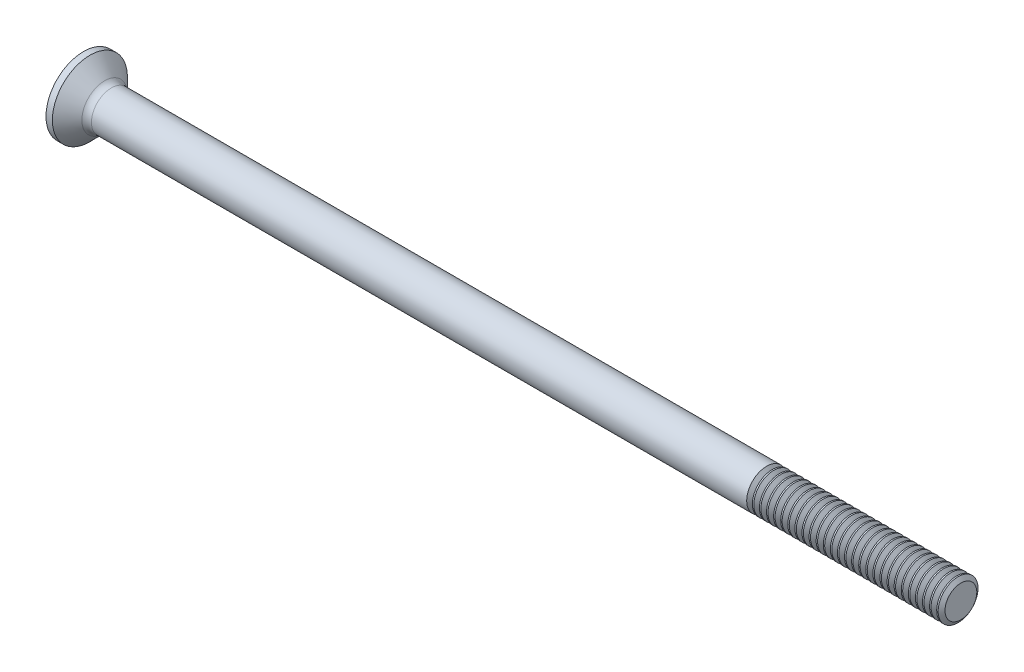
from build123d import *

# Parameters (mm, degrees)
FILLET1_R       = 0.6
RECPAT_COUNT    = 2
RECPAT_ANGLE    = 90
THDSCHPAT_COUNT = 28
THDSCHPAT_PITCH = 0.444444444


with BuildPart() as part:
    # BodySke → Base-Revolve (revolve)
    with BuildSketch(Plane.XY, mode=Mode.PRIVATE) as base_revolve_sk:
        Polygon((0, 0), (0, 2.35), (0.4, 2.35), (1.5, 1.25), (55, 1.25), (55, 0), align=None)
    revolve(base_revolve_sk.sketch.rotate(Axis((-6.35, 0, 0), (1, 0, 0)), 90), axis=Axis((-6.35, 0, 0), (1, 0, 0)))

    # Fillet1
    fillet1_edges = [part.edges().sort_by_distance(p)[0] for p in [
        (1.5, 0, -1.25),
    ]]
    fillet(fillet1_edges, radius=FILLET1_R)

    # Sketch3 → Recess section 0
    with BuildSketch(Plane.ZY):
        with BuildLine():
            Line((-0.37, 1.4), (0.37, 1.4))
            Line((0.37, 1.4), (0.37, -1.4))
            Line((0.37, -1.4), (-0.37, -1.4))
            Line((-0.37, -1.4), (-0.37, 1.4))
        make_face()
    # Sketch4 → Recess section 1
    with BuildSketch(Plane.ZY.offset(-1.73)):
        with BuildLine():
            Line((-0.37, 0.537453848), (0.37, 0.537453848))
            Line((0.37, 0.537453848), (0.37, -0.537453848))
            Line((0.37, -0.537453848), (-0.37, -0.537453848))
            Line((-0.37, -0.537453848), (-0.37, 0.537453848))
        make_face()
    recess = loft(mode=Mode.SUBTRACT)

    # RecPat: Recess ×2 about axis
    recpat_axis = Axis((0, 0, 0), (1, 0, 0))
    for i in range(1, RECPAT_COUNT):
        add(recess.rotate(recpat_axis, i * RECPAT_ANGLE / (RECPAT_COUNT - 1)), mode=Mode.SUBTRACT)

    # RecCorSke → RecessCore (revolve, cut)
    with BuildSketch(Plane.XY, mode=Mode.PRIVATE) as recesscore_sk:
        Polygon((0, 0), (0, 0.676973385), (1.73, 0.556), (1.910655351, 0), align=None)
    revolve(recesscore_sk.sketch.rotate(Axis((-3.175, 0, 0), (1, 0, 0)), 90), axis=Axis((-3.175, 0, 0), (1, 0, 0)), mode=Mode.SUBTRACT)

    # ThdSchSke → ThreadSchematic (revolve, cut)
    with BuildSketch(Plane.XY, mode=Mode.PRIVATE) as threadschematic_sk:
        Polygon((43.000001, -0.9965), (42.822498389, -1.25), (42.822498389, -1.5625), (43.177503611, -1.5625), (43.177503611, -1.25), align=None)
    threadschematic = revolve(threadschematic_sk.sketch.rotate(Axis((-3.175, 0, 0), (1, 0, 0)), 270), axis=Axis((-3.175, 0, 0), (1, 0, 0)), mode=Mode.SUBTRACT)

    # ThdSchPat: ThreadSchematic ×28
    with Locations(*[(i * THDSCHPAT_PITCH, 0, 0) for i in range(1, THDSCHPAT_COUNT)]):
        add(threadschematic, mode=Mode.SUBTRACT)


solid = part.part
